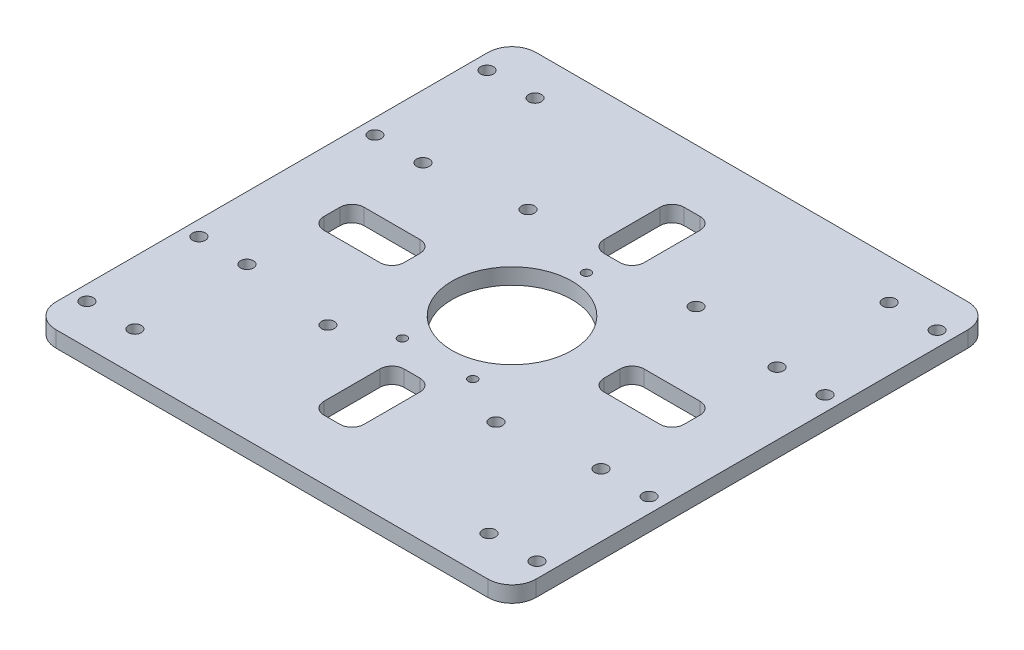
from build123d import *

# Parameters (mm, degrees)
SKETCH_1_R      = 1.1
SKETCH_1_R_2    = 1.6
SKETCH_1_R_3    = 15
EXTRUDE_1_DEPTH = 4


with BuildPart() as part:
    # 草图1 → 凸台-拉伸1 (new body)
    with BuildSketch(Plane(origin=(0, 0, 0), x_dir=(1, 0, 0), z_dir=(0, 1, 0))):
        with BuildLine():
            Line((-54, 60), (54, 60))
            ThreePointArc((54, 60), (58.242640687, 58.242640687), (60, 54))
            Line((60, 54), (60, -54))
            ThreePointArc((60, -54), (58.242640687, -58.242640687), (54, -60))
            Line((54, -60), (-54, -60))
            ThreePointArc((-54, -60), (-58.242640687, -58.242640687), (-60, -54))
            Line((-60, -54), (-60, 54))
            ThreePointArc((-60, 54), (-58.242640687, 58.242640687), (-54, 60))
        make_face()
        with Locations(Location((0, 18.6, 0), (0, 0, 270))):
            Circle(SKETCH_1_R, mode=Mode.SUBTRACT)
        with Locations(Location((8.8, -18.6, 0), (0, 0, 270))):
            Circle(SKETCH_1_R, mode=Mode.SUBTRACT)
        with Locations(Location((-8.8, -18.6, 0), (0, 0, 270))):
            Circle(SKETCH_1_R, mode=Mode.SUBTRACT)
        with Locations(Location((-21, 25, 0), (0, 0, 270))):
            Circle(SKETCH_1_R_2, mode=Mode.SUBTRACT)
        with Locations(Location((21, 25, 0), (0, 0, 90))):
            Circle(SKETCH_1_R_2, mode=Mode.SUBTRACT)
        with Locations(Location((21, -25, 0), (0, 0, 270))):
            Circle(SKETCH_1_R_2, mode=Mode.SUBTRACT)
        with Locations(Location((-21, -25, 0), (0, 0, 90))):
            Circle(SKETCH_1_R_2, mode=Mode.SUBTRACT)
        with Locations(Location((-56.25, 50, 0), (0, 0, 270))):
            Circle(SKETCH_1_R_2, mode=Mode.SUBTRACT)
        with Locations(Location((-44.25, 50, 0), (0, 0, 270))):
            Circle(SKETCH_1_R_2, mode=Mode.SUBTRACT)
        with Locations(Location((-44.25, 22, 0), (0, 0, 270))):
            Circle(SKETCH_1_R_2, mode=Mode.SUBTRACT)
        with Locations(Location((-56.25, 22, 0), (0, 0, 270))):
            Circle(SKETCH_1_R_2, mode=Mode.SUBTRACT)
        with Locations(Location((56.25, 22, 0), (0, 0, 270))):
            Circle(SKETCH_1_R_2, mode=Mode.SUBTRACT)
        with Locations(Location((44.25, 22, 0), (0, 0, 270))):
            Circle(SKETCH_1_R_2, mode=Mode.SUBTRACT)
        with Locations(Location((44.25, 50, 0), (0, 0, 270))):
            Circle(SKETCH_1_R_2, mode=Mode.SUBTRACT)
        with Locations(Location((56.25, 50, 0), (0, 0, 270))):
            Circle(SKETCH_1_R_2, mode=Mode.SUBTRACT)
        with Locations(Location((56.25, -50, 0), (0, 0, 270))):
            Circle(SKETCH_1_R_2, mode=Mode.SUBTRACT)
        with Locations(Location((44.25, -50, 0), (0, 0, 270))):
            Circle(SKETCH_1_R_2, mode=Mode.SUBTRACT)
        with Locations(Location((44.25, -22, 0), (0, 0, 270))):
            Circle(SKETCH_1_R_2, mode=Mode.SUBTRACT)
        with Locations(Location((56.25, -22, 0), (0, 0, 270))):
            Circle(SKETCH_1_R_2, mode=Mode.SUBTRACT)
        with Locations(Location((-44.25, -50, 0), (0, 0, 270))):
            Circle(SKETCH_1_R_2, mode=Mode.SUBTRACT)
        with Locations(Location((-56.25, -50, 0), (0, 0, 270))):
            Circle(SKETCH_1_R_2, mode=Mode.SUBTRACT)
        with Locations(Location((-56.25, -22, 0), (0, 0, 270))):
            Circle(SKETCH_1_R_2, mode=Mode.SUBTRACT)
        with Locations(Location((-44.25, -22, 0), (0, 0, 270))):
            Circle(SKETCH_1_R_2, mode=Mode.SUBTRACT)
        with Locations(Location((0, 0, 0), (0, 0, 270))):
            Circle(SKETCH_1_R_3, mode=Mode.SUBTRACT)
        with BuildLine():
            Line((-2, -25), (2, -25))
            ThreePointArc((2, -25), (4.121320344, -25.878679656), (5, -28))
            Line((5, -28), (5, -42))
            ThreePointArc((5, -42), (4.121320344, -44.121320344), (2, -45))
            Line((2, -45), (-2, -45))
            ThreePointArc((-2, -45), (-4.121320344, -44.121320344), (-5, -42))
            Line((-5, -42), (-5, -28))
            ThreePointArc((-5, -28), (-4.121320344, -25.878679656), (-2, -25))
        make_face(mode=Mode.SUBTRACT)
        with BuildLine():
            Line((-45, 2), (-45, -2))
            ThreePointArc((-45, -2), (-44.121320344, -4.121320344), (-42, -5))
            Line((-42, -5), (-28, -5))
            ThreePointArc((-28, -5), (-25.878679656, -4.121320344), (-25, -2))
            Line((-25, -2), (-25, 2))
            ThreePointArc((-25, 2), (-25.878679656, 4.121320344), (-28, 5))
            Line((-28, 5), (-42, 5))
            ThreePointArc((-42, 5), (-44.121320344, 4.121320344), (-45, 2))
        make_face(mode=Mode.SUBTRACT)
        with BuildLine():
            Line((2, 45), (-2, 45))
            ThreePointArc((-2, 45), (-4.121320344, 44.121320344), (-5, 42))
            Line((-5, 42), (-5, 28))
            ThreePointArc((-5, 28), (-4.121320344, 25.878679656), (-2, 25))
            Line((-2, 25), (2, 25))
            ThreePointArc((2, 25), (4.121320344, 25.878679656), (5, 28))
            Line((5, 28), (5, 42))
            ThreePointArc((5, 42), (4.121320344, 44.121320344), (2, 45))
        make_face(mode=Mode.SUBTRACT)
        with BuildLine():
            Line((45, -2), (45, 2))
            ThreePointArc((45, 2), (44.121320344, 4.121320344), (42, 5))
            Line((42, 5), (28, 5))
            ThreePointArc((28, 5), (25.878679656, 4.121320344), (25, 2))
            Line((25, 2), (25, -2))
            ThreePointArc((25, -2), (25.878679656, -4.121320344), (28, -5))
            Line((28, -5), (42, -5))
            ThreePointArc((42, -5), (44.121320344, -4.121320344), (45, -2))
        make_face(mode=Mode.SUBTRACT)
    extrude(amount=EXTRUDE_1_DEPTH)


solid = part.part
